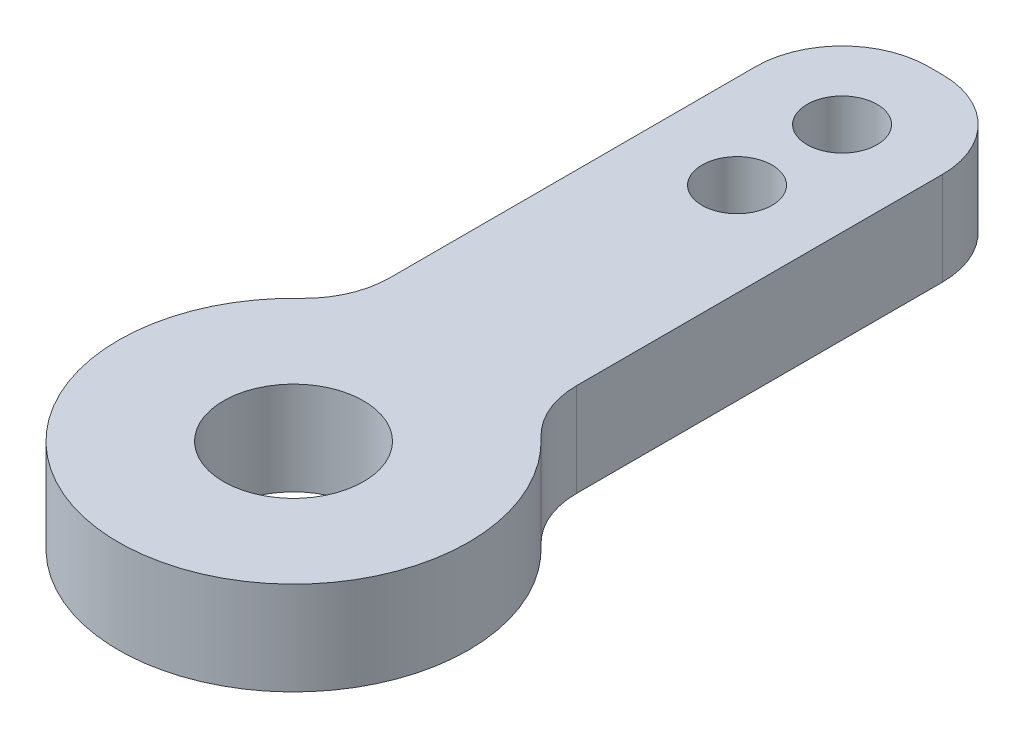
from build123d import *

# Parameters (mm, degrees)
SKETCH1_R           = 3
SKETCH1_R_2         = 1.5
BOSS_EXTRUDE1_DEPTH = 4


with BuildPart() as part:
    # Sketch1 → Boss-Extrude1 (new body)
    with BuildSketch(Plane(origin=(0, 0, 0), x_dir=(1, 0, 0), z_dir=(0, 1, 0))):
        with BuildLine():
            Line((-4, 8.8), (-4, -6.866734973))
            ThreePointArc((-4, -6.866734973), (-4.301332982, -8.329288391), (-5.15625, -9.553617169))
            ThreePointArc((-5.15625, -9.553617169), (0, -22.5), (5.15625, -9.553617169))
            ThreePointArc((5.15625, -9.553617169), (4.301332982, -8.329288391), (4, -6.866734973))
            Line((4, -6.866734973), (4, 8.8))
            ThreePointArc((4, 8.8), (2.91629509, 11.41629509), (0.3, 12.5))
            Line((0.3, 12.5), (-0.3, 12.5))
            ThreePointArc((-0.3, 12.5), (-2.91629509, 11.41629509), (-4, 8.8))
        make_face()
        with Locations(Location((0, -15, 0), (0, 0, 270))):
            Circle(SKETCH1_R, mode=Mode.SUBTRACT)
        with Locations(Location((0, 8.5, 0), (0, 0, 270))):
            Circle(SKETCH1_R_2, mode=Mode.SUBTRACT)
        with Locations(Location((0, 4, 0), (0, 0, 270))):
            Circle(SKETCH1_R_2, mode=Mode.SUBTRACT)
    extrude(amount=BOSS_EXTRUDE1_DEPTH)


solid = part.part
